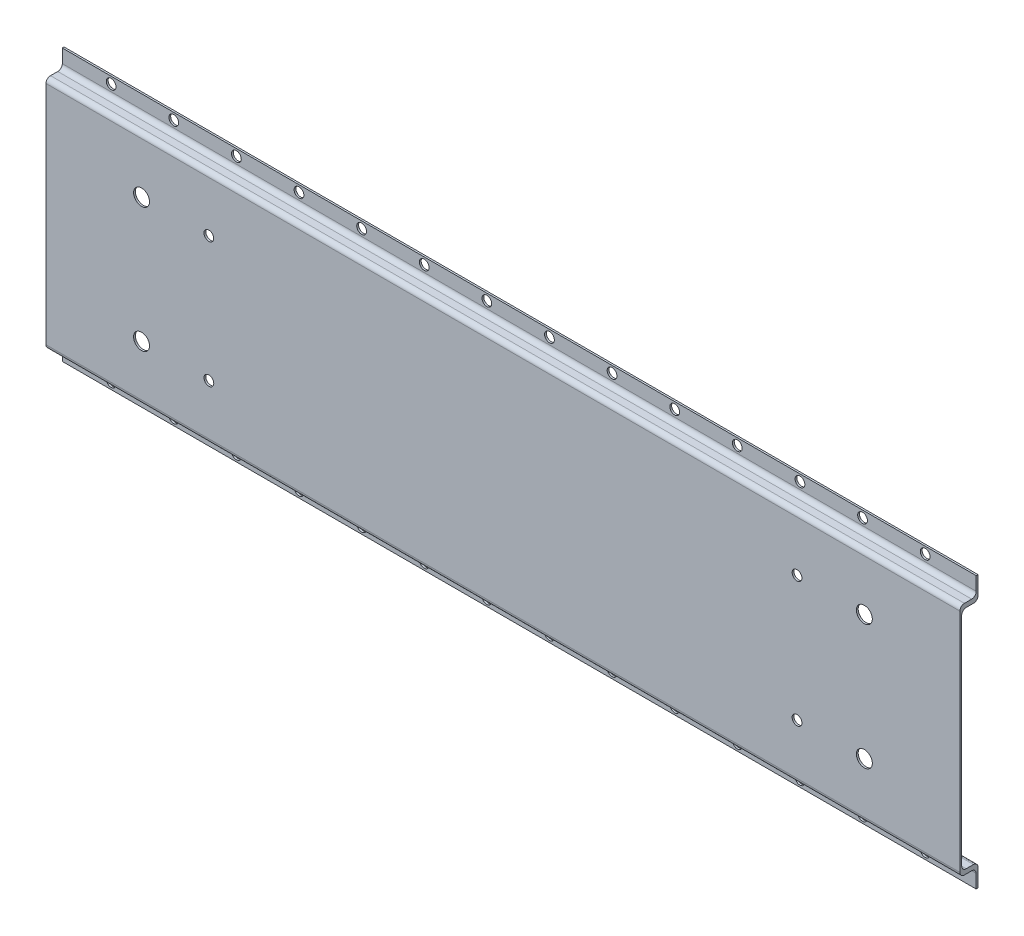
from build123d import *

# Parameters (mm, degrees)
SKETCH1_W           = 641.35
SKETCH1_H           = 190.5
BOSS_EXTRUDE1_DEPTH = 12.7
SKETCH2_W           = 641.35
SKETCH2_H           = 12.7
CUT_EXTRUDE1_DEPTH  = 11.43
SKETCH4_W           = 641.35
SKETCH4_H           = 158.75
CUT_EXTRUDE2_DEPTH  = 11.43
FILLET2_R           = 3.175
SKETCH6_R           = 3.429
CUT_EXTRUDE3_DEPTH  = 11.43
SKETCH8_R           = 5.588
CUT_EXTRUDE4_DEPTH  = 11.43
SKETCH9_R           = 3.429
CUT_EXTRUDE5_DEPTH  = 11.43


with BuildPart() as part:
    # Sketch1 → Boss-Extrude1 (new body)
    with BuildSketch(Plane.XY):
        Rectangle(SKETCH1_W, SKETCH1_H)
    extrude(amount=BOSS_EXTRUDE1_DEPTH)

    # Sketch2 → Cut-Extrude1 (cut)
    with BuildSketch(Plane.XY.offset(12.7)):
        with Locations((0, 88.9)):
            Rectangle(SKETCH2_W, SKETCH2_H)
        with Locations((0, -88.9)):
            Rectangle(SKETCH2_W, SKETCH2_H)
    extrude(amount=-CUT_EXTRUDE1_DEPTH, mode=Mode.SUBTRACT)

    # Sketch4 → Cut-Extrude2 (cut)
    with BuildSketch(Plane(origin=(0, 0, 0), x_dir=(-1, 0, 0), z_dir=(0, 0, -1))):
        Rectangle(SKETCH4_W, SKETCH4_H)
    extrude(amount=-CUT_EXTRUDE2_DEPTH, mode=Mode.SUBTRACT)

    # Fillet2
    fillet2_edges = [part.edges().sort_by_distance(p)[0] for p in [
        (0, 82.55, 1.27),
        (0, 82.55, 12.7),
        (0, -82.55, 12.7),
        (0, -82.55, 1.27),
        (0, 79.375, 0),
        (0, -79.375, 11.43),
        (0, 79.375, 11.43),
        (0, -79.375, 0),
    ]]
    fillet(fillet2_edges, radius=FILLET2_R)

    # Sketch6 → Cut-Extrude3 (cut)
    with BuildSketch(Plane.XY.offset(1.27)):
        with Locations((-286.385, 90.4875)):
            Circle(SKETCH6_R)
        with Locations((-242.443, 90.4875)):
            Circle(SKETCH6_R)
        with Locations((-198.501, 90.4875)):
            Circle(SKETCH6_R)
        with Locations((-154.559, 90.4875)):
            Circle(SKETCH6_R)
        with Locations((-110.617, 90.4875)):
            Circle(SKETCH6_R)
        with Locations((-66.675, 90.4875)):
            Circle(SKETCH6_R)
        with Locations((-22.733, 90.4875)):
            Circle(SKETCH6_R)
        with Locations((21.209, 90.4875)):
            Circle(SKETCH6_R)
        with Locations((65.151, 90.4875)):
            Circle(SKETCH6_R)
        with Locations((109.093, 90.4875)):
            Circle(SKETCH6_R)
        with Locations((153.035, 90.4875)):
            Circle(SKETCH6_R)
        with Locations((196.977, 90.4875)):
            Circle(SKETCH6_R)
        with Locations((240.919, 90.4875)):
            Circle(SKETCH6_R)
        with Locations((284.861, 90.4875)):
            Circle(SKETCH6_R)
        with Locations(Location((284.861, -90.4875, 0), (0, 0, 180))):
            Circle(SKETCH6_R)
        with Locations(Location((240.919, -90.4875, 0), (0, 0, 180))):
            Circle(SKETCH6_R)
        with Locations(Location((196.977, -90.4875, 0), (0, 0, 180))):
            Circle(SKETCH6_R)
        with Locations(Location((153.035, -90.4875, 0), (0, 0, 180))):
            Circle(SKETCH6_R)
        with Locations(Location((109.093, -90.4875, 0), (0, 0, 180))):
            Circle(SKETCH6_R)
        with Locations(Location((65.151, -90.4875, 0), (0, 0, 180))):
            Circle(SKETCH6_R)
        with Locations(Location((21.209, -90.4875, 0), (0, 0, 180))):
            Circle(SKETCH6_R)
        with Locations(Location((-22.733, -90.4875, 0), (0, 0, 180))):
            Circle(SKETCH6_R)
        with Locations(Location((-66.675, -90.4875, 0), (0, 0, 180))):
            Circle(SKETCH6_R)
        with Locations(Location((-110.617, -90.4875, 0), (0, 0, 180))):
            Circle(SKETCH6_R)
        with Locations(Location((-154.559, -90.4875, 0), (0, 0, 180))):
            Circle(SKETCH6_R)
        with Locations(Location((-198.501, -90.4875, 0), (0, 0, 180))):
            Circle(SKETCH6_R)
        with Locations(Location((-242.443, -90.4875, 0), (0, 0, 180))):
            Circle(SKETCH6_R)
        with Locations(Location((-286.385, -90.4875, 0), (0, 0, 180))):
            Circle(SKETCH6_R)
    extrude(amount=-CUT_EXTRUDE3_DEPTH, mode=Mode.SUBTRACT)

    # Sketch8 → Cut-Extrude4 (cut)
    with BuildSketch(Plane.XY.offset(12.7)):
        with Locations((-253.619, 43.815)):
            Circle(SKETCH8_R)
        with Locations(Location((253.619, 43.815, 0), (0, 0, 180))):
            Circle(SKETCH8_R)
        with Locations((253.619, -43.815)):
            Circle(SKETCH8_R)
        with Locations(Location((-253.619, -43.815, 0), (0, 0, 180))):
            Circle(SKETCH8_R)
    extrude(amount=-CUT_EXTRUDE4_DEPTH, mode=Mode.SUBTRACT)

    # Sketch9 → Cut-Extrude5 (cut)
    with BuildSketch(Plane.XY.offset(12.7)):
        with Locations((-206.375, 44.015279051)):
            Circle(SKETCH9_R)
        with Locations(Location((206.375, 44.015279051, 0), (0, 0, 180))):
            Circle(SKETCH9_R)
        with Locations((206.375, -44.015279051)):
            Circle(SKETCH9_R)
        with Locations(Location((-206.375, -44.015279051, 0), (0, 0, 180))):
            Circle(SKETCH9_R)
    extrude(amount=-CUT_EXTRUDE5_DEPTH, mode=Mode.SUBTRACT)


solid = part.part
